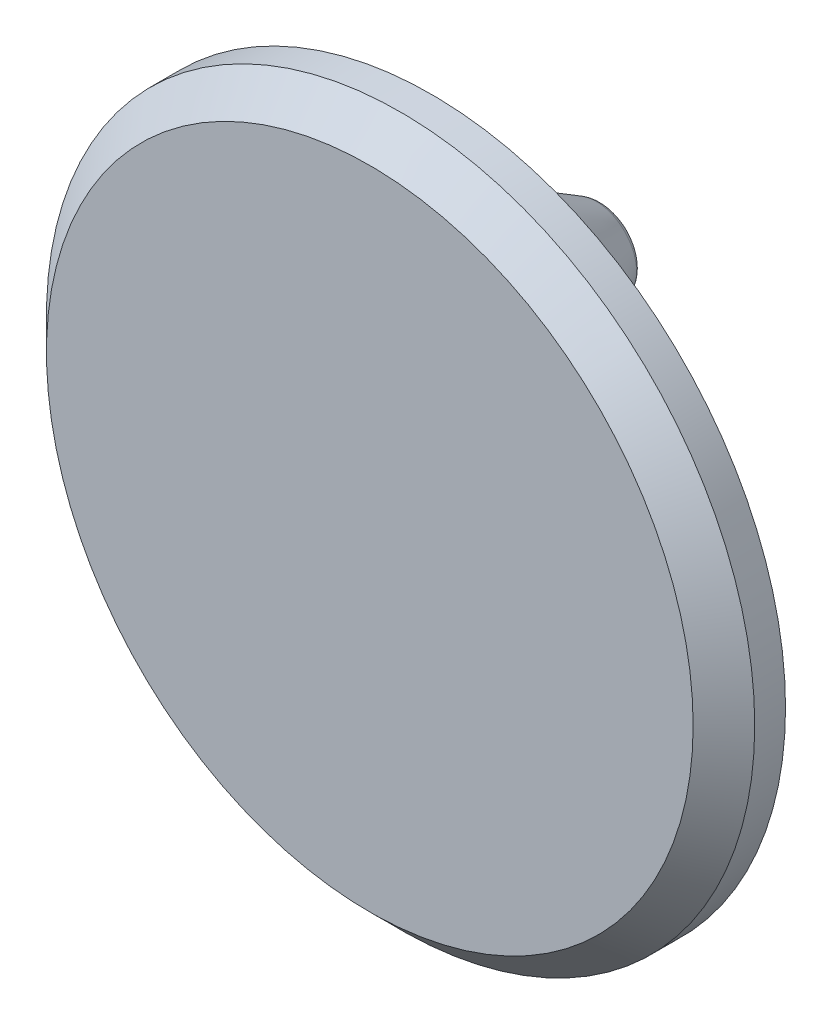
from build123d import *

# Parameters (mm, degrees)
SKETCH1_R           = 11.5
BOSS_EXTRUDE1_DEPTH = 2
CHAMFER1_SIZE       = 1
FILLET2_R           = 0.5


with BuildPart() as part:
    # Sketch1 → Boss-Extrude1 (new body)
    with BuildSketch(Plane.XY):
        Circle(SKETCH1_R)
    extrude(amount=BOSS_EXTRUDE1_DEPTH)

    # Sketch3 → Revolve1 (revolve)
    with BuildSketch(Plane(origin=(0, 0, 0), x_dir=(0, 0, -1), z_dir=(1, 0, 0)), mode=Mode.PRIVATE) as revolve1_sk:
        Polygon((0, 4.5), (0, 6.9), (2.6, 6.9), (2.6, 7.4), (5.6, 5.667949192), (5.6, 4.5), align=None)
    revolve(revolve1_sk.sketch.rotate(Axis((0, 4.5, 0), (0, 0, -1)), 180), axis=Axis((0, 4.5, 0), (0, 0, -1)))

    # Chamfer1
    chamfer1_edges = [part.edges().sort_by_distance(p)[0] for p in [
        (-11.5, 0, 2),
    ]]
    chamfer(chamfer1_edges, length=CHAMFER1_SIZE)

    # Fillet2
    fillet2_edges = [part.edges().sort_by_distance(p)[0] for p in [
        (0, 5.667949192, -5.6),
    ]]
    fillet(fillet2_edges, radius=FILLET2_R)


solid = part.part
